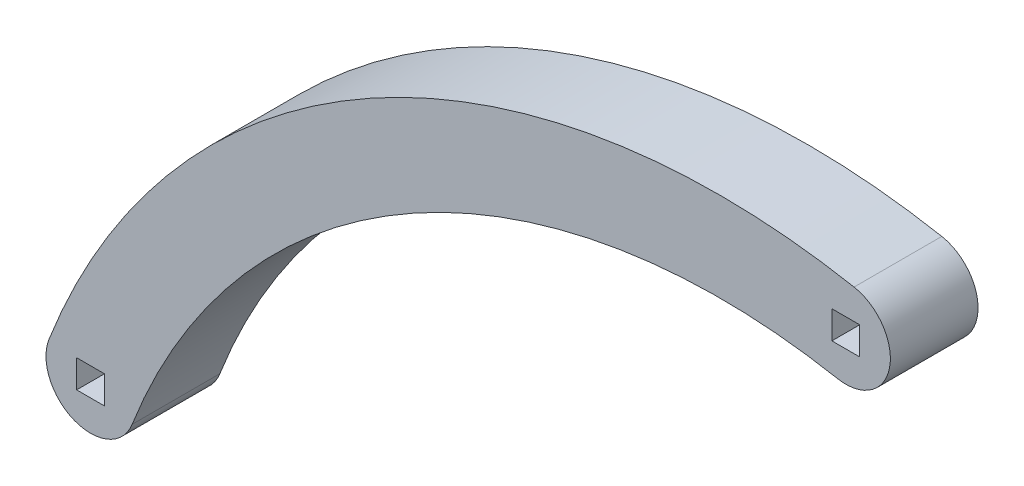
from build123d import *

# Parameters (mm, degrees)
SKETCH1_W           = 3.175
SKETCH1_H           = 3.175
BOSS_EXTRUDE1_DEPTH = 10


with BuildPart() as part:
    # Sketch1 → Boss-Extrude1 (new body)
    with BuildSketch(Plane.XY):
        with BuildLine():
            ThreePointArc((87.048054742, 52.882382784), (31.917584067, 43.964642964), (-4.738476051, 1.831186697))
            ThreePointArc((-4.738476051, 1.831186697), (-1.831186697, -4.738476051), (4.738476051, -1.831186697))
            ThreePointArc((4.738476051, -1.831186697), (36.856053246, 35.085615868), (85.160675784, 42.899226937))
            ThreePointArc((85.160675784, 42.899226937), (91.095943187, 46.947115382), (87.048054742, 52.882382784))
        make_face()
        Rectangle(SKETCH1_W, SKETCH1_H, mode=Mode.SUBTRACT)
        with Locations((86.104365263, 47.890804861)):
            Rectangle(SKETCH1_W, SKETCH1_H, mode=Mode.SUBTRACT)
    extrude(amount=BOSS_EXTRUDE1_DEPTH)


solid = part.part
